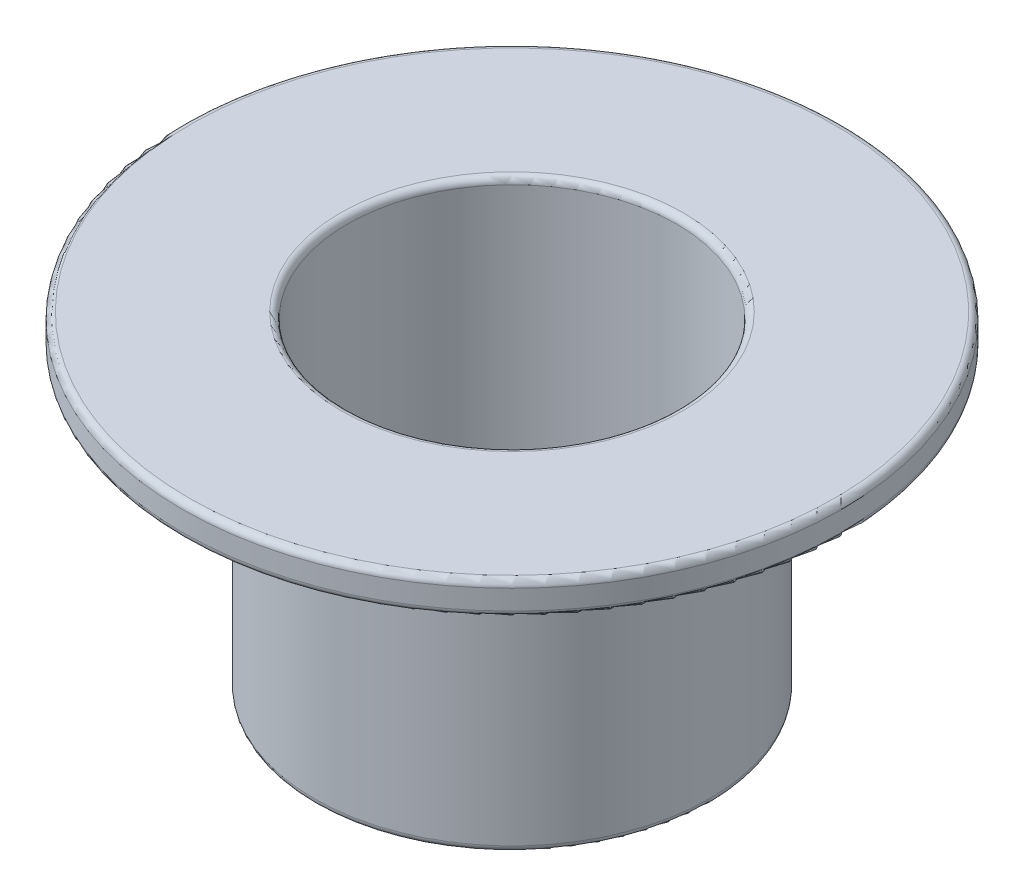
from build123d import *

# Parameters (mm, degrees)
SKETCH1_R           = 3
SKETCH1_R_2         = 2.5
BOSS_EXTRUDE1_DEPTH = 4.5
SKETCH2_R           = 5
SKETCH2_R_2         = 2.5
BOSS_EXTRUDE2_DEPTH = 0.5
FILLET1_R           = 0.1


with BuildPart() as part:
    # Sketch1 → Boss-Extrude1 (new body)
    with BuildSketch(Plane(origin=(0, 0, 0), x_dir=(1, 0, 0), z_dir=(0, 1, 0))):
        with Locations(Location((0, 0, 0), (0, 0, 270))):
            Circle(SKETCH1_R)
        with Locations(Location((0, 0, 0), (0, 0, 270))):
            Circle(SKETCH1_R_2, mode=Mode.SUBTRACT)
    extrude(amount=BOSS_EXTRUDE1_DEPTH)

    # Sketch2 → Boss-Extrude2 (add)
    with BuildSketch(Plane(origin=(0, 4.5, 0), x_dir=(1, 0, 0), z_dir=(0, 1, 0))):
        with Locations(Location((0, 0, 0), (0, 0, 270))):
            Circle(SKETCH2_R)
        with Locations(Location((0, 0, 0), (0, 0, 270))):
            Circle(SKETCH2_R_2, mode=Mode.SUBTRACT)
    extrude(amount=BOSS_EXTRUDE2_DEPTH)

    # Fillet1
    fillet1_edges = [part.edges().sort_by_distance(p)[0] for p in [
        (0, 4.5, -5),
        (0, 5, -2.5),
        (0, 0, -3),
        (0, 0, -2.5),
        (0, 5, -5),
    ]]
    fillet(fillet1_edges, radius=FILLET1_R)


solid = part.part
